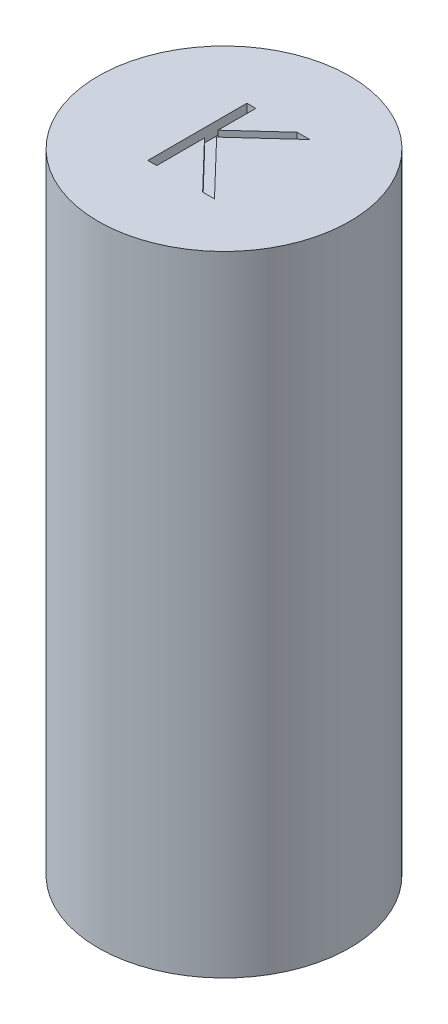
from build123d import *

# Parameters (mm, degrees)
SKETCH1_R           = 19.05
BOSS_EXTRUDE1_DEPTH = 95.25
CUT_EXTRUDE1_DEPTH  = 2


with BuildPart() as part:
    # Sketch1 → Boss-Extrude1 (new body)
    with BuildSketch(Plane(origin=(0, 0, 0), x_dir=(1, 0, 0), z_dir=(0, 1, 0))):
        with Locations(Location((0, 0, 0), (0, 0, 270))):
            Circle(SKETCH1_R)
    extrude(amount=BOSS_EXTRUDE1_DEPTH)

    # Sketch2 → Cut-Extrude1 (cut)
    with BuildSketch(Plane(origin=(0, 95.25, 0), x_dir=(1, 0, 0), z_dir=(0, 1, 0))):
        Polygon((-4.230769231, 7.695432728), (-2.884615385, 7.695432728), (-2.884615385, 1.983293305), (3.368389423, 7.695432728), (5.288461538, 7.695432728), (-2.082331731, 0.964663498), (5.865384615, -7.304567272), (4.071514423, -7.304567272), (-2.884615385, -0.065985541), (-2.884615385, -7.304567272), (-4.230769231, -7.304567272), align=None)
    extrude(amount=-CUT_EXTRUDE1_DEPTH, mode=Mode.SUBTRACT)


solid = part.part
